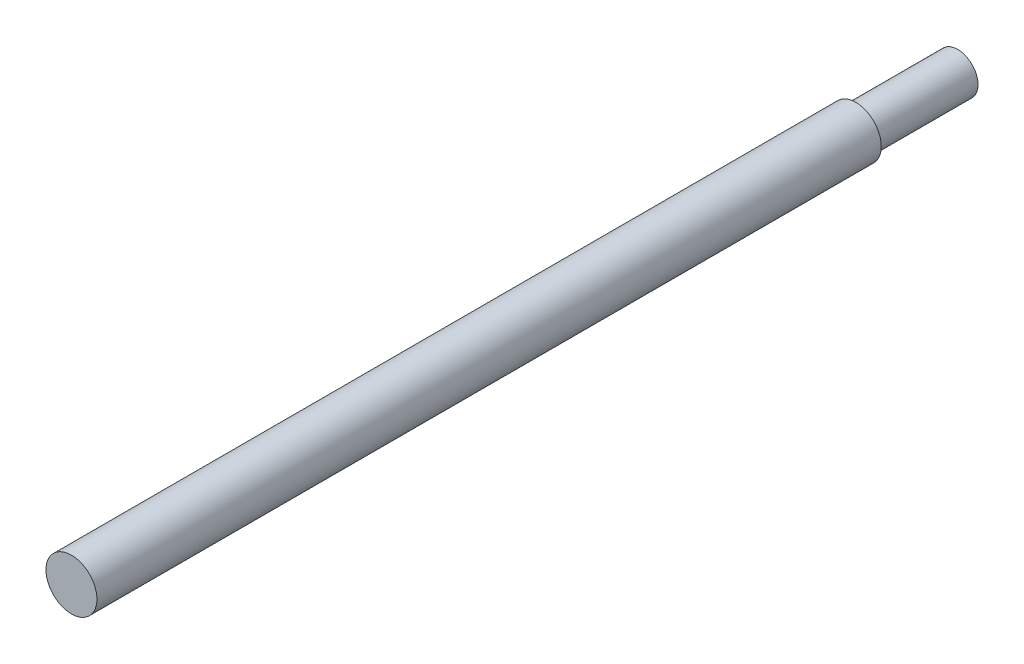
from build123d import *

# Parameters (mm, degrees)
ESQUISSE1_R        = 2.5
BOSS_EXTRU_1_DEPTH = 87
ESQUISSE2_W        = 10
ESQUISSE2_H        = 0.5


with BuildPart() as part:
    # Esquisse1 → Boss.-Extru.1 (new body)
    with BuildSketch(Plane.XY):
        Circle(ESQUISSE1_R)
    extrude(amount=BOSS_EXTRU_1_DEPTH)

    # Esquisse2 → Enlèvement de matière-Révolution1 (revolve, cut)
    with BuildSketch(Plane(origin=(0, 0, 0), x_dir=(0, 0, -1), z_dir=(1, 0, 0)), mode=Mode.PRIVATE) as enl_vement_de_mati_re_r_volution1_sk:
        with Locations((-5, 2.25)):
            Rectangle(ESQUISSE2_W, ESQUISSE2_H)
    revolve(enl_vement_de_mati_re_r_volution1_sk.sketch.rotate(Axis((0, 0, 0), (0, 0, 1)), 90), axis=Axis((0, 0, 0), (0, 0, 1)), mode=Mode.SUBTRACT)


solid = part.part
